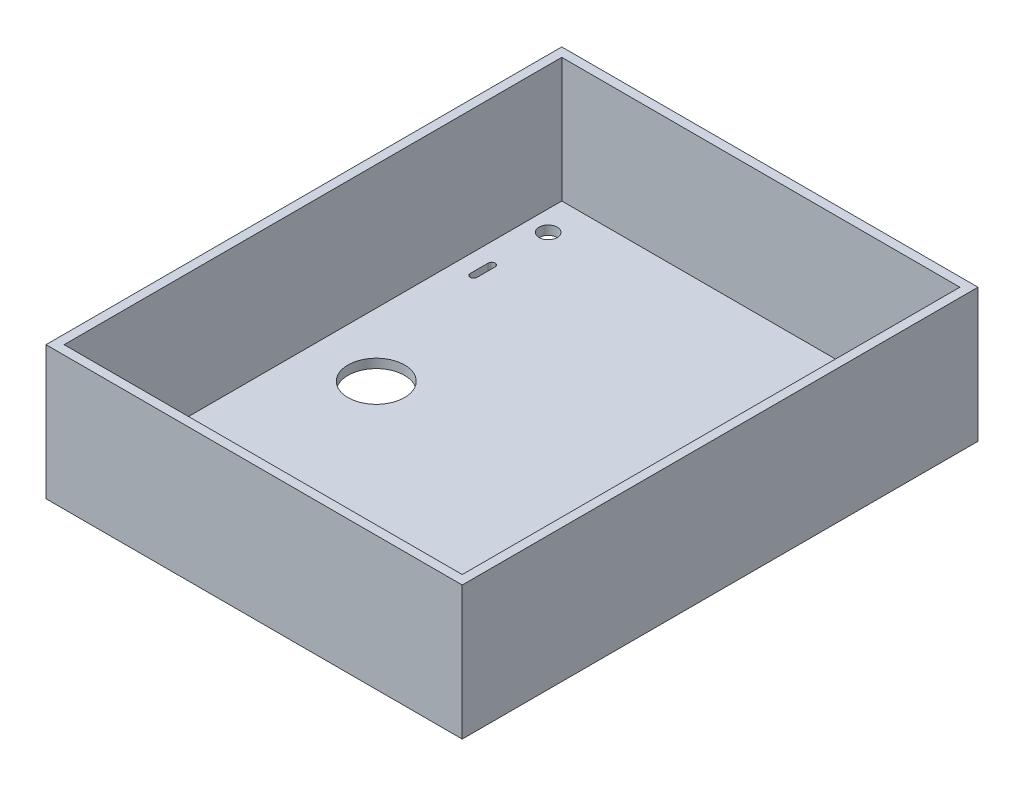
from build123d import *

# Parameters (mm, degrees)
SKETCH1_W           = 184
SKETCH1_H           = 228
BOSS_EXTRUDE1_DEPTH = 59
SKETCH2_W           = 176
SKETCH2_H           = 220
CUT_EXTRUDE1_DEPTH  = 55
SKETCH4_R           = 4
CUT_EXTRUDE2_DEPTH  = 157.476835346
SKETCH6_R           = 12.5
CUT_EXTRUDE3_DEPTH  = 157.476835346


with BuildPart() as part:
    # Sketch1 → Boss-Extrude1 (new body)
    with BuildSketch(Plane(origin=(0, 0, 0), x_dir=(1, 0, 0), z_dir=(0, 1, 0))):
        Rectangle(SKETCH1_W, SKETCH1_H)
    extrude(amount=BOSS_EXTRUDE1_DEPTH)

    # Sketch2 → Cut-Extrude1 (cut)
    with BuildSketch(Plane(origin=(0, 59, 0), x_dir=(1, 0, 0), z_dir=(0, 1, 0))):
        Rectangle(SKETCH2_W, SKETCH2_H)
    extrude(amount=-CUT_EXTRUDE1_DEPTH, mode=Mode.SUBTRACT)

    # Sketch4 → Cut-Extrude2 (cut, through all)
    with BuildSketch(Plane(origin=(0, 4, 0), x_dir=(1, 0, 0), z_dir=(0, 1, 0))):
        with Locations(Location((-79, -95, 0), (0, 0, 270))):
            Circle(SKETCH4_R)
        with Locations(Location((-79, 95, 0), (0, 0, 270))):
            Circle(SKETCH4_R)
        with Locations(Location((79, -95, 0), (0, 0, 270))):
            Circle(SKETCH4_R)
        with Locations(Location((79, 95, 0), (0, 0, 270))):
            Circle(SKETCH4_R)
        with BuildLine():
            Line((-77.5, 70), (-77.5, 62))
            ThreePointArc((-77.5, 62), (-79, 60.5), (-80.5, 62))
            Line((-80.5, 62), (-80.5, 70))
            ThreePointArc((-80.5, 70), (-79, 71.5), (-77.5, 70))
        make_face()
        with BuildLine():
            Line((-77.5, -62), (-77.5, -70))
            ThreePointArc((-77.5, -70), (-79, -71.5), (-80.5, -70))
            Line((-80.5, -70), (-80.5, -62))
            ThreePointArc((-80.5, -62), (-79, -60.5), (-77.5, -62))
        make_face()
        with BuildLine():
            Line((80.5, -62), (80.5, -70))
            ThreePointArc((80.5, -70), (79, -71.5), (77.5, -70))
            Line((77.5, -70), (77.5, -62))
            ThreePointArc((77.5, -62), (79, -60.5), (80.5, -62))
        make_face()
        with BuildLine():
            Line((79, 70), (79, 62))
            ThreePointArc((79, 62), (77.5, 60.5), (76, 62))
            Line((76, 62), (76, 70))
            ThreePointArc((76, 70), (77.5, 71.5), (79, 70))
        make_face()
    extrude(amount=-CUT_EXTRUDE2_DEPTH, mode=Mode.SUBTRACT)

    # Sketch6 → Cut-Extrude3 (cut, through all)
    with BuildSketch(Plane(origin=(0, 4, 0), x_dir=(1, 0, 0), z_dir=(0, 1, 0))):
        with Locations(Location((-60, 0, 0), (0, 0, 270))):
            Circle(SKETCH6_R)
        with Locations(Location((0, -80, 0), (0, 0, 270))):
            Circle(SKETCH6_R)
    extrude(amount=-CUT_EXTRUDE3_DEPTH, mode=Mode.SUBTRACT)


solid = part.part
